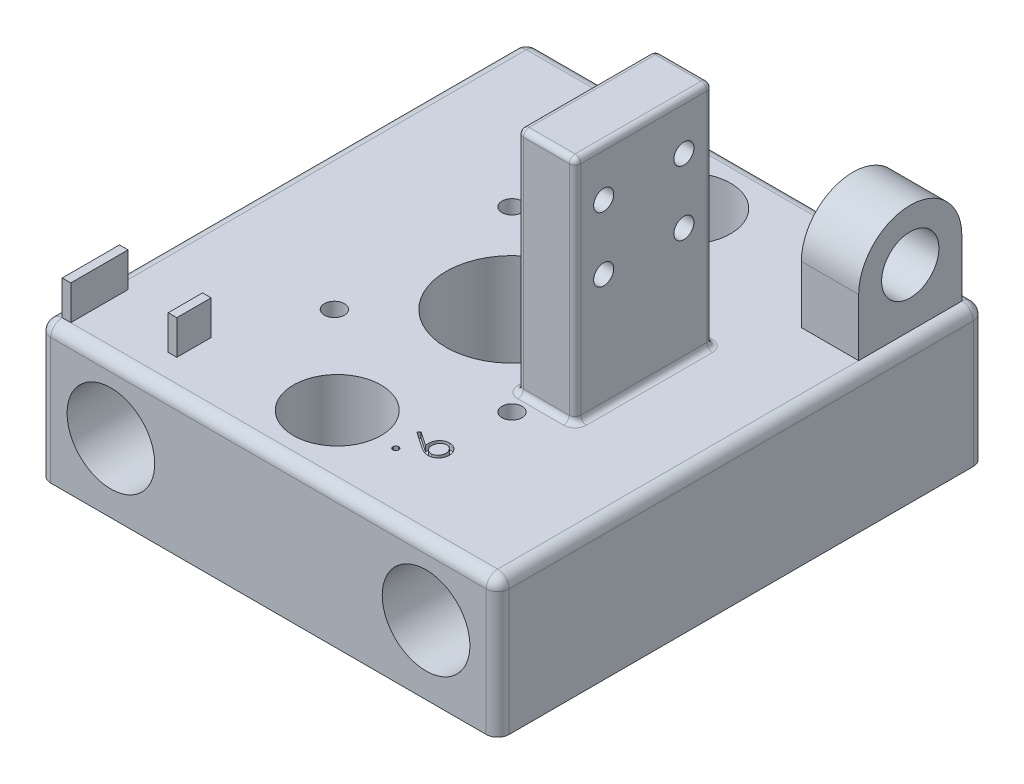
from build123d import *

# Parameters (mm, degrees)
CROQUIS1_W              = 80
CROQUIS1_H              = 24
SALIENTE_EXTRUIR1_DEPTH = 85
CROQUIS2_R              = 7.65
CORTAR_EXTRUIR1_DEPTH   = 95.704804524
REDONDEO1_R             = 2
CROQUIS3_R              = 7.65
CORTAR_EXTRUIR2_DEPTH   = 97.958754117
CROQUIS5_R              = 1.627289227
CORTAR_EXTRUIR3_DEPTH   = 1
CROQUIS6_R              = 11.5
CORTAR_EXTRUIR4_DEPTH   = 32
CROQUIS7_R              = 1.75
CORTAR_EXTRUIR5_DEPTH   = 30
CROQUIS8_W              = 10
CROQUIS8_H              = 24
SALIENTE_EXTRUIR2_DEPTH = 40
REDONDEO2_R             = 1
REDONDEO3_R             = 1
CORTAR_EXTRUIR6_REACH   = 114.863
CROQUIS9_R              = 1.75
CORTAR_EXTRUIR7_DEPTH   = 1
CROQUIS11_W             = 1.5
CROQUIS11_H             = 10
SALIENTE_EXTRUIR3_DEPTH = 6
CROQUIS12_W             = 1.5
CROQUIS12_H             = 6
SALIENTE_EXTRUIR4_DEPTH = 6
CROQUIS13_W             = 10
CROQUIS13_H             = 18
SALIENTE_EXTRUIR5_DEPTH = 10
CROQUIS14_R             = 9
SALIENTE_EXTRUIR6_DEPTH = 10
CROQUIS15_R             = 5
CORTAR_EXTRUIR8_DEPTH   = 10


with BuildPart() as part:
    # Croquis1 → Saliente-Extruir1 (new body)
    with BuildSketch(Plane.XY):
        Rectangle(CROQUIS1_W, CROQUIS1_H)
    extrude(amount=SALIENTE_EXTRUIR1_DEPTH)

    # Croquis2 → Cortar-Extruir1 (cut, through all)
    with BuildSketch(Plane(origin=(0, 0, 0), x_dir=(-1, 0, 0), z_dir=(0, 0, -1))):
        with Locations((-27.5, 0)):
            Circle(CROQUIS2_R)
        with Locations((27.5, 0)):
            Circle(CROQUIS2_R)
    extrude(amount=-CORTAR_EXTRUIR1_DEPTH, mode=Mode.SUBTRACT)

    # Redondeo1
    redondeo1_edges = [part.edges().sort_by_distance(p)[0] for p in [
        (-40, 0, 85),
        (40, 0, 85),
        (-40, 0, 0),
        (0, 12, 0),
        (40, 0, 0),
        (0, 12, 85),
        (-40, 12, 42.5),
        (40, 12, 42.5),
    ]]
    fillet(redondeo1_edges, radius=REDONDEO1_R)

    # Croquis3 → Cortar-Extruir2 (cut, through all)
    with BuildSketch(Plane(origin=(0, 12, 0), x_dir=(1, 0, 0), z_dir=(0, 1, 0))):
        with Locations(Location((0, -12, 0), (0, 0, 270))):
            Circle(CROQUIS3_R)
        with Locations(Location((0, -73, 0), (0, 0, 270))):
            Circle(CROQUIS3_R)
    extrude(amount=-CORTAR_EXTRUIR2_DEPTH, mode=Mode.SUBTRACT)

    # Croquis5 → Cortar-Extruir3 (cut)
    with BuildSketch(Plane(origin=(0, 12, 0), x_dir=(1, 0, 0), z_dir=(0, 1, 0))):
        with Locations(Location((0, -42.5, 0), (0, 0, 270))):
            Circle(CROQUIS5_R)
    extrude(amount=-CORTAR_EXTRUIR3_DEPTH, mode=Mode.SUBTRACT)

    # Croquis6 → Cortar-Extruir4 (cut)
    with BuildSketch(Plane(origin=(0, 12, 0), x_dir=(1, 0, 0), z_dir=(0, 1, 0))):
        with Locations(Location((0, -42.5, 0), (0, 0, 270))):
            Circle(CROQUIS6_R)
    extrude(amount=-CORTAR_EXTRUIR4_DEPTH, mode=Mode.SUBTRACT)

    # Croquis7 → Cortar-Extruir5 (cut)
    with BuildSketch(Plane.XZ.offset(12)):
        with Locations(Location((15.5, 58, 0), (0, 0, 270))):
            Circle(CROQUIS7_R)
        with Locations(Location((15.5, 27, 0), (0, 0, 270))):
            Circle(CROQUIS7_R)
        with Locations(Location((-15.5, 27, 0), (0, 0, 270))):
            Circle(CROQUIS7_R)
        with Locations(Location((-15.5, 58, 0), (0, 0, 270))):
            Circle(CROQUIS7_R)
    extrude(amount=-CORTAR_EXTRUIR5_DEPTH, mode=Mode.SUBTRACT)

    # Croquis8 → Saliente-Extruir2 (add)
    with BuildSketch(Plane(origin=(0, 12, 0), x_dir=(1, 0, 0), z_dir=(0, 1, 0))):
        with Locations((18, -42.5)):
            Rectangle(CROQUIS8_W, CROQUIS8_H)
    extrude(amount=SALIENTE_EXTRUIR2_DEPTH)

    # Redondeo2
    redondeo2_edges = [part.edges().sort_by_distance(p)[0] for p in [
        (13, 32, 30.5),
        (13, 32, 54.5),
        (23, 32, 54.5),
        (23, 32, 30.5),
        (13, 52, 42.5),
        (18, 52, 54.5),
        (23, 52, 42.5),
        (18, 52, 30.5),
    ]]
    fillet(redondeo2_edges, radius=REDONDEO2_R)

    # Redondeo3
    redondeo3_edges = [part.edges().sort_by_distance(p)[0] for p in [
        (18, 12, 30.5),
        (23, 12, 42.5),
        (18, 12, 54.5),
        (13, 12, 42.5),
        (22.707106781, 12, 30.792893219),
        (22.707106781, 12, 54.207106781),
        (13.292893219, 12, 30.792893219),
        (13.292893219, 12, 54.207106781),
    ]]
    fillet(redondeo3_edges, radius=REDONDEO3_R)

    # Croquis9 → Cortar-Extruir6 (cut, up to next)
    with BuildSketch(Plane.ZY.offset(-13), mode=Mode.PRIVATE) as cortar_extruir6_sk1:
        with Locations((35.5, 43.555)):
            Circle(CROQUIS9_R)
    cortar_extruir6_tool1 = extrude(cortar_extruir6_sk1.sketch, amount=-CORTAR_EXTRUIR6_REACH, mode=Mode.PRIVATE) & part.part
    # Croquis9 → Cortar-Extruir6 (cut, up to next)
    with BuildSketch(Plane.ZY.offset(-13), mode=Mode.PRIVATE) as cortar_extruir6_sk2:
        with Locations((35.5, 32.305)):
            Circle(CROQUIS9_R)
    cortar_extruir6_tool2 = extrude(cortar_extruir6_sk2.sketch, amount=-CORTAR_EXTRUIR6_REACH, mode=Mode.PRIVATE) & part.part
    # Croquis9 → Cortar-Extruir6 (cut, up to next)
    with BuildSketch(Plane.ZY.offset(-13), mode=Mode.PRIVATE) as cortar_extruir6_sk3:
        with Locations((49.5, 43.555)):
            Circle(CROQUIS9_R)
    cortar_extruir6_tool3 = extrude(cortar_extruir6_sk3.sketch, amount=-CORTAR_EXTRUIR6_REACH, mode=Mode.PRIVATE) & part.part
    # Croquis9 → Cortar-Extruir6 (cut, up to next)
    with BuildSketch(Plane.ZY.offset(-13), mode=Mode.PRIVATE) as cortar_extruir6_sk4:
        with Locations((49.5, 32.305)):
            Circle(CROQUIS9_R)
    cortar_extruir6_tool4 = extrude(cortar_extruir6_sk4.sketch, amount=-CORTAR_EXTRUIR6_REACH, mode=Mode.PRIVATE) & part.part
    add(cortar_extruir6_tool1.solids().sort_by_distance((13, 43.555, 35.5))[0], mode=Mode.SUBTRACT)
    add(cortar_extruir6_tool2.solids().sort_by_distance((13, 32.305, 35.5))[0], mode=Mode.SUBTRACT)
    add(cortar_extruir6_tool3.solids().sort_by_distance((13, 43.555, 49.5))[0], mode=Mode.SUBTRACT)
    add(cortar_extruir6_tool4.solids().sort_by_distance((13, 32.305, 49.5))[0], mode=Mode.SUBTRACT)

    # Croquis10 → Cortar-Extruir7 (cut)
    # profile 1 of 2: a face of its own
    with BuildSketch(Plane(origin=(0, 12, 0), x_dir=(1, 0, 0), z_dir=(0, 1, 0))):
        with BuildLine():
            add(Edge.make_bspline(
                [(11.35361441, -73.634615385), (11.351694589, -73.668050302), (11.347953132, -73.733210197), (11.320455282, -73.827563694), (11.274058494, -73.91378576), (11.210308832, -73.990113125), (11.134200409, -74.053550945), (11.04819737, -74.100481594), (10.953570329, -74.129239869), (10.887470489, -74.132794643), (10.85361441, -74.134615385)],
                knots=[0, 0, 0, 0, 1.020591893, 1.988988293, 2.974634352, 3.991697318, 5.008760285, 5.983632262, 6.967224335, 8, 8, 8, 8], degree=3))
            add(Edge.make_bspline(
                [(10.85361441, -74.134615385), (10.820572412, -74.132721908), (10.755301596, -74.128981555), (10.661390561, -74.1005413), (10.575330338, -74.053183501), (10.498187235, -73.990546121), (10.434301105, -73.913767186), (10.38831803, -73.82735524), (10.358896076, -73.733436393), (10.355403433, -73.668088366), (10.35361441, -73.634615385)],
                knots=[0, 0, 0, 0, 1.009852967, 1.994853009, 2.971120474, 3.99910934, 5.017628188, 6.004685157, 6.977947174, 8, 8, 8, 8], degree=3))
            add(Edge.make_bspline(
                [(10.35361441, -73.634615385), (10.355470596, -73.601166506), (10.359115677, -73.53548138), (10.3877305, -73.441210652), (10.434741948, -73.355321772), (10.498069155, -73.278527886), (10.575729963, -73.216410755), (10.660804656, -73.166871241), (10.755572878, -73.14070677), (10.820625844, -73.136664986), (10.85361441, -73.134615385)],
                knots=[0, 0, 0, 0, 1.021616397, 2.006195831, 2.982046417, 4.000130345, 5.027680246, 6.00943514, 6.990578253, 8, 8, 8, 8], degree=3))
            add(Edge.make_bspline(
                [(10.85361441, -73.134615385), (10.887415148, -73.136597808), (10.953294591, -73.140461657), (11.048783035, -73.166931917), (11.133804593, -73.216036521), (11.21042573, -73.278961909), (11.273619064, -73.3553029), (11.321033911, -73.441008031), (11.34773678, -73.53570368), (11.351628981, -73.601203592), (11.35361441, -73.634615385)],
                knots=[0, 0, 0, 0, 1.032329927, 2.012066096, 2.992413168, 4.009037178, 5.025661188, 6.000112418, 6.979848586, 8, 8, 8, 8], degree=3))
        make_face()
    # profile 2 of 2: a face of its own
    with BuildSketch(Plane(origin=(0, 12, 0), x_dir=(1, 0, 0), z_dir=(0, 1, 0))):
        with BuildLine():
            Line((10.276691333, -69.365384615), (10.575970179, -68.935096154))
            Line((10.575970179, -68.935096154), (13.014672102, -70.603365385))
            add(Edge.make_bspline(
                [(13.014672102, -70.603365385), (13.001655422, -70.496924124), (12.976024853, -70.287335346), (12.971316302, -70.076243171), (12.968999025, -69.972355769)],
                knots=[0, 0, 0, 0, 1.015715272, 2, 2, 2, 2], degree=3))
            add(Edge.make_bspline(
                [(12.968999025, -69.972355769), (12.970617083, -69.909371144), (12.97379319, -69.785737832), (12.99882539, -69.603944506), (13.037815968, -69.429003994), (13.0946474, -69.26158265), (13.167279463, -69.101829617), (13.255754792, -68.949187427), (13.360402718, -68.803858198), (13.480098378, -68.667552012), (13.611551296, -68.543591111), (13.750674002, -68.433150632), (13.899090276, -68.341365974), (14.053770567, -68.265120362), (14.216938619, -68.207296737), (14.386737585, -68.165189527), (14.564357544, -68.139265492), (14.685257768, -68.136181328), (14.746643256, -68.134615385)],
                knots=[0, 0, 0, 0, 1.060702494, 2.082066239, 3.085748733, 4.076089625, 5.054723785, 6.037561548, 7.043420247, 8.066922603, 9.088643095, 10.08373341, 11.053858765, 12.022809492, 12.983497605, 13.964038393, 14.966267459, 16, 16, 16, 16], degree=3))
            add(Edge.make_bspline(
                [(14.746643256, -68.134615385), (14.830589518, -68.137588701), (14.995359, -68.143424719), (15.236102604, -68.190393606), (15.463736679, -68.267639902), (15.677662726, -68.37534569), (15.874803422, -68.511005213), (16.05241818, -68.67404851), (16.207980787, -68.863483878), (16.341702062, -69.07499591), (16.449247772, -69.303601089), (16.528515144, -69.543033074), (16.575141569, -69.79145728), (16.581288759, -69.959744714), (16.58438364, -70.044471154)],
                knots=[0, 0, 0, 0, 1.022988612, 2.007919123, 2.978103895, 3.94594894, 4.918897164, 5.887013414, 6.875921846, 7.89917871, 8.930658928, 9.948724884, 10.967259574, 12, 12, 12, 12], degree=3))
            add(Edge.make_bspline(
                [(16.58438364, -70.044471154), (16.581257492, -70.127597398), (16.575080518, -70.291847022), (16.529444936, -70.533699473), (16.453350614, -70.765547239), (16.347709942, -70.985566182), (16.214433581, -71.188226933), (16.056933402, -71.371166617), (15.873434732, -71.529484259), (15.6689568, -71.662907711), (15.449237522, -71.769996239), (15.219894825, -71.84726379), (14.982570998, -71.894827539), (14.821780512, -71.90082127), (14.74063364, -71.903846154)],
                knots=[0, 0, 0, 0, 1.026337322, 2.02794581, 3.027878252, 4.032696425, 5.033228651, 6.015458494, 7.004668777, 8.016190509, 9.023163053, 10.0152653, 10.998354841, 12, 12, 12, 12], degree=3))
            add(Edge.make_bspline(
                [(14.74063364, -71.903846154), (14.677639282, -71.901850976), (14.549870985, -71.897804258), (14.355933973, -71.868732945), (14.157782032, -71.821648568), (13.989844653, -71.767032699), (13.852549619, -71.711105893), (13.742366881, -71.662988224), (13.627382571, -71.606982936), (13.508441779, -71.540456858), (13.382415182, -71.470906256), (13.252055051, -71.391825936), (13.116632927, -71.305622594), (13.025354924, -71.244195311), (12.97861441, -71.212740385)],
                knots=[0, 0, 0, 0, 1.179688711, 2.392703466, 3.66501481, 4.991562144, 5.695278944, 6.441221078, 7.243328977, 8.089575748, 8.993388627, 9.939305498, 10.944784961, 12, 12, 12, 12], degree=3))
            Line((12.97861441, -71.212740385), (10.276691333, -69.365384615))
        make_face()
        with BuildLine():
            add(Edge.make_bspline(
                [(13.58438364, -70.072115385), (13.585687155, -70.119830837), (13.588224656, -70.212716603), (13.603669071, -70.348791972), (13.631053047, -70.477233464), (13.670343982, -70.598384177), (13.717755414, -70.713458866), (13.778118819, -70.820629714), (13.850147336, -70.919986415), (13.931078791, -71.01219429), (14.020994077, -71.094075432), (14.115103403, -71.167006342), (14.213819877, -71.228995886), (14.318379756, -71.277961504), (14.426237827, -71.318220776), (14.539131008, -71.346023083), (14.656471123, -71.361424797), (14.736183108, -71.364050354), (14.776691333, -71.365384615)],
                knots=[0, 0, 0, 0, 1.163407946, 2.26475976, 3.333800367, 4.359385343, 5.366239384, 6.363380779, 7.350133999, 8.353570782, 9.349036268, 10.310270964, 11.253520213, 12.184142, 13.120487599, 14.056272588, 15.012232024, 16, 16, 16, 16], degree=3))
            add(Edge.make_bspline(
                [(14.776691333, -71.365384615), (14.817216562, -71.364236715), (14.897076496, -71.361974637), (15.014589064, -71.343823483), (15.127210817, -71.311900104), (15.235529867, -71.269038449), (15.338762712, -71.212682042), (15.437582713, -71.144803927), (15.533211333, -71.065742894), (15.620723564, -70.972959397), (15.702434663, -70.873133187), (15.773269506, -70.765797779), (15.833734859, -70.653615619), (15.883203623, -70.536497318), (15.921883378, -70.41419909), (15.949679185, -70.286714324), (15.965060806, -70.153420337), (15.967669565, -70.062937995), (15.968999025, -70.016826923)],
                knots=[0, 0, 0, 0, 0.972051712, 1.915547132, 2.843788449, 3.775556853, 4.704594175, 5.659091977, 6.648619647, 7.675179132, 8.714041218, 9.74046568, 10.755438548, 11.767722258, 12.786148662, 13.828784001, 14.893517844, 16, 16, 16, 16], degree=3))
            add(Edge.make_bspline(
                [(15.968999025, -70.016826923), (15.967667659, -69.971116761), (15.965055531, -69.881433799), (15.949705699, -69.749326437), (15.921706342, -69.622697642), (15.883184943, -69.500775924), (15.834003932, -69.383904483), (15.773269964, -69.272614673), (15.702056301, -69.166397739), (15.620827614, -69.0666), (15.532791203, -68.974015445), (15.438000553, -68.893562059), (15.338710393, -68.82584123), (15.235543772, -68.769406683), (15.127207106, -68.726565813), (15.014590069, -68.69463687), (14.897076234, -68.67648721), (14.817216473, -68.674224927), (14.776691333, -68.673076923)],
                knots=[0, 0, 0, 0, 1.099545523, 2.15729926, 3.193054709, 4.213957097, 5.228701859, 6.237665598, 7.258567987, 8.299955741, 9.329010984, 10.327149711, 11.283968076, 12.215264062, 13.149297769, 14.079795814, 15.025585048, 16, 16, 16, 16], degree=3))
            add(Edge.make_bspline(
                [(14.776691333, -68.673076923), (14.736151563, -68.674115654), (14.656199718, -68.67616422), (14.538725902, -68.695926145), (14.42611757, -68.728974625), (14.317279786, -68.773236438), (14.213270886, -68.831524878), (14.11458398, -68.903051474), (14.020100351, -68.986889553), (13.931287988, -69.081918389), (13.849769973, -69.185920951), (13.778575032, -69.297001087), (13.718450842, -69.413246522), (13.67020847, -69.53506646), (13.631445618, -69.661558117), (13.60371954, -69.793858342), (13.588372797, -69.931529607), (13.585726117, -70.024803861), (13.58438364, -70.072115385)],
                knots=[0, 0, 0, 0, 0.952633368, 1.87876736, 2.791047057, 3.707742249, 4.635551637, 5.587206343, 6.568248508, 7.601284464, 8.641511608, 9.671105535, 10.699146789, 11.713763218, 12.747829548, 13.806491675, 14.887386225, 16, 16, 16, 16], degree=3))
        make_face(mode=Mode.SUBTRACT)
    extrude(amount=-CORTAR_EXTRUIR7_DEPTH, mode=Mode.SUBTRACT)

    # Croquis11 → Saliente-Extruir3 (add)
    with BuildSketch(Plane(origin=(0, 12, 0), x_dir=(1, 0, 0), z_dir=(0, 1, 0))):
        with Locations((-37.25, -78)):
            Rectangle(CROQUIS11_W, CROQUIS11_H)
    extrude(amount=SALIENTE_EXTRUIR3_DEPTH)

    # Croquis12 → Saliente-Extruir4 (add)
    with BuildSketch(Plane(origin=(0, 12, 0), x_dir=(1, 0, 0), z_dir=(0, 1, 0))):
        with Locations((-22.75, -76)):
            Rectangle(CROQUIS12_W, CROQUIS12_H)
    extrude(amount=SALIENTE_EXTRUIR4_DEPTH)

    # Croquis13 → Saliente-Extruir5 (add)
    with BuildSketch(Plane(origin=(0, 12, 0), x_dir=(1, 0, 0), z_dir=(0, 1, 0))):
        with Locations((33, -11)):
            Rectangle(CROQUIS13_W, CROQUIS13_H)
    extrude(amount=SALIENTE_EXTRUIR5_DEPTH)

    # Croquis14 → Saliente-Extruir6 (add)
    with BuildSketch(Plane(origin=(38, 0, 0), x_dir=(0, 0, -1), z_dir=(1, 0, 0))):
        with Locations((-11, 22)):
            Circle(CROQUIS14_R)
    extrude(amount=-SALIENTE_EXTRUIR6_DEPTH)

    # Croquis15 → Cortar-Extruir8 (cut)
    with BuildSketch(Plane(origin=(38, 0, 0), x_dir=(0, 0, -1), z_dir=(1, 0, 0))):
        with Locations((-11, 22)):
            Circle(CROQUIS15_R)
    extrude(amount=-CORTAR_EXTRUIR8_DEPTH, mode=Mode.SUBTRACT)


solid = part.part
